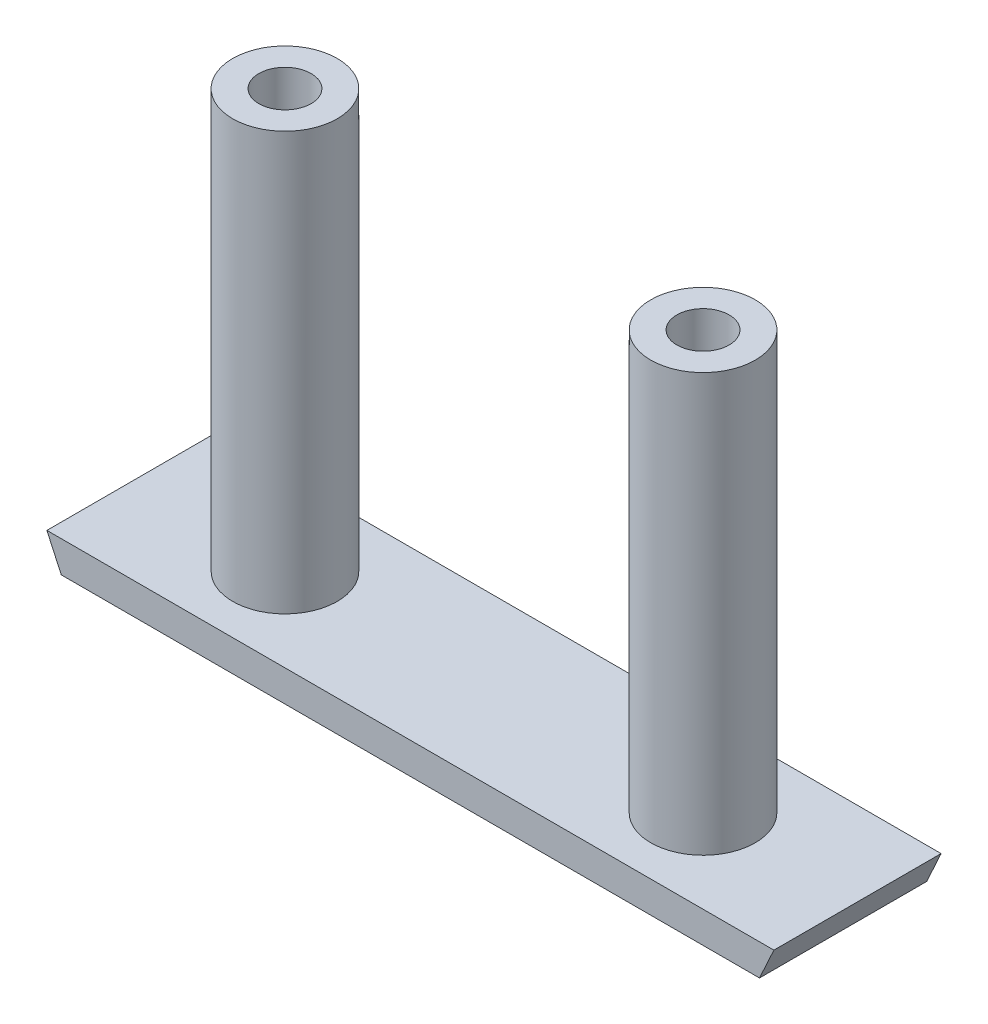
from build123d import *

# Parameters (mm, degrees)
BOSS_EXTRUDE1_DEPTH = 20.32
SKETCH2_R           = 6.35
SKETCH2_R_2         = 3.175
BOSS_EXTRUDE2_DEPTH = 50.8


with BuildPart() as part:
    # Sketch1 → Boss-Extrude1 (new body)
    with BuildSketch(Plane.XY):
        Polygon((-44.173002637, -17.9705), (44.173002637, -17.9705), (42.424083396, -21.7805), (-42.424083396, -21.7805), align=None)
    extrude(amount=BOSS_EXTRUDE1_DEPTH)

    # Sketch2 → Boss-Extrude2 (add)
    # profile 1 of 2: a face of its own
    with BuildSketch(Plane(origin=(0, -17.9705, 0), x_dir=(1, 0, 0), z_dir=(0, 1, 0))):
        with Locations(Location((-25.4, -10.16, 0), (0, 0, 90))):
            Circle(SKETCH2_R)
        with Locations(Location((-25.4, -10.16, 0), (0, 0, 270))):
            Circle(SKETCH2_R_2, mode=Mode.SUBTRACT)
    # profile 2 of 2: a face of its own
    with BuildSketch(Plane(origin=(0, -17.9705, 0), x_dir=(1, 0, 0), z_dir=(0, 1, 0))):
        with Locations(Location((25.4, -10.16, 0), (0, 0, 90))):
            Circle(SKETCH2_R)
        with Locations(Location((25.4, -10.16, 0), (0, 0, 270))):
            Circle(SKETCH2_R_2, mode=Mode.SUBTRACT)
    extrude(amount=BOSS_EXTRUDE2_DEPTH)


solid = part.part
